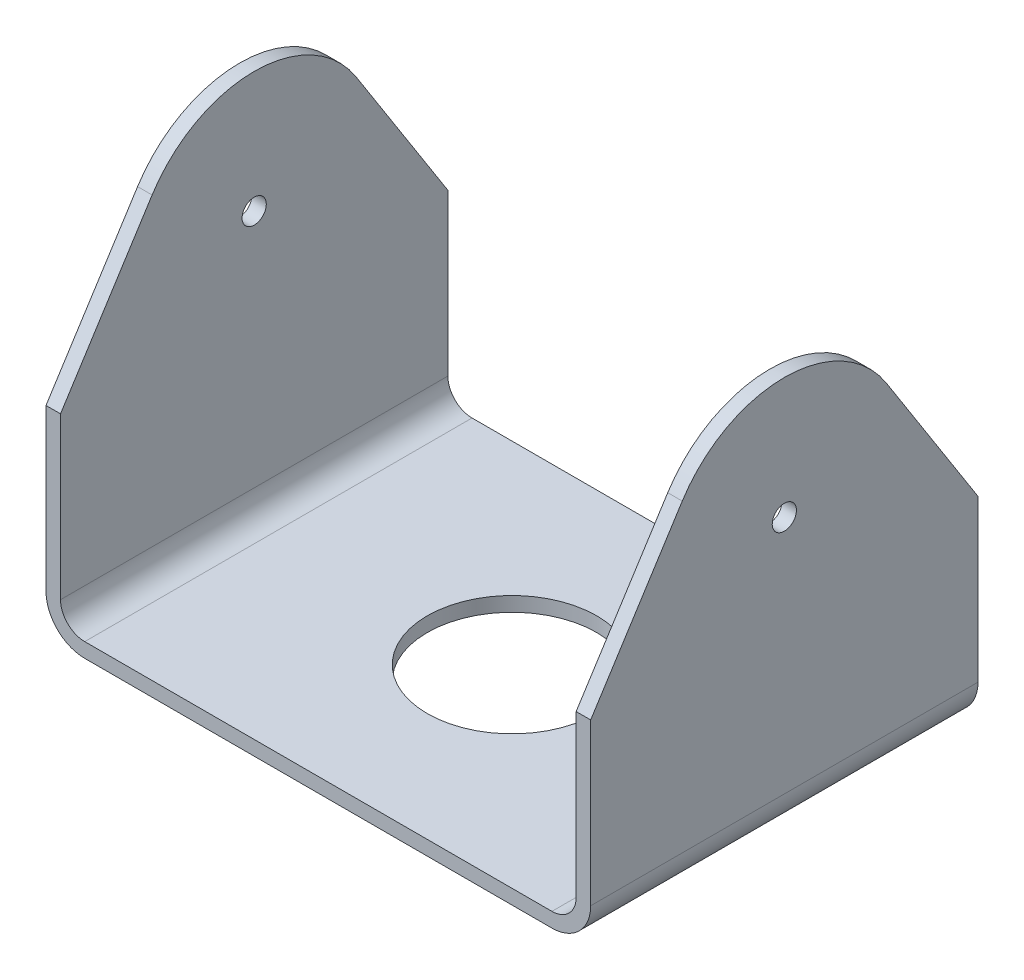
from build123d import *

# Parameters (mm, degrees)
EXTRU_MINCE1_DEPTH      = 40
ENL_V_MAT_EXTRU_1_REACH = 107.282
ESQUISSE2_R             = 17.5
ENL_V_MAT_EXTRU_2_DEPTH = 146.129252737
ESQUISSE4_R             = 2.5
ENL_V_MAT_EXTRU_3_DEPTH = 146.129252737


with BuildPart() as part:
    # Esquisse1 → Extru.-Mince1 (new, symmetric)
    with BuildSketch(Plane.XY):
        with BuildLine():
            Line((-56.25, 82.5), (-56.25, 8))
            ThreePointArc((-56.25, 8), (-53.906854249, 2.343145751), (-48.25, 0))
            Line((-48.25, 0), (48.25, 0))
            ThreePointArc((48.25, 0), (53.906854249, 2.343145751), (56.25, 8))
            Line((56.25, 8), (56.25, 82.5))
            Line((56.25, 82.5), (53.25, 82.5))
            Line((53.25, 82.5), (53.25, 8))
            ThreePointArc((53.25, 8), (51.785533906, 4.464466094), (48.25, 3))
            Line((48.25, 3), (-48.25, 3))
            ThreePointArc((-48.25, 3), (-51.785533906, 4.464466094), (-53.25, 8))
            Line((-53.25, 8), (-53.25, 82.5))
            Line((-53.25, 82.5), (-56.25, 82.5))
        make_face()
    extrude(amount=EXTRU_MINCE1_DEPTH, both=True)

    # Esquisse2 → Enlèv. mat.-Extru.1 (cut, up to next)
    with BuildSketch(Plane(origin=(0, 3, 0), x_dir=(-1, 0, 0), z_dir=(0, 1, 0)), mode=Mode.PRIVATE) as enl_v_mat_extru_1_sk1:
        with Locations(Location((0, 0, 0), (0, 0, 90))):
            Circle(ESQUISSE2_R)
    enl_v_mat_extru_1_tool1 = extrude(enl_v_mat_extru_1_sk1.sketch, amount=-ENL_V_MAT_EXTRU_1_REACH, mode=Mode.PRIVATE) & part.part
    add(enl_v_mat_extru_1_tool1.solids().sort_by_distance((0, 3, 0))[0], mode=Mode.SUBTRACT)

    # Esquisse3 → Enlèv. mat.-Extru.2 (cut, through all)
    with BuildSketch(Plane(origin=(56.25, 0, 0), x_dir=(0, 0, -1), z_dir=(1, 0, 0))):
        with BuildLine():
            Line((-40, 41.241551833), (-21.084786145, 70.932490209))
            ThreePointArc((-21.084786145, 70.932490209), (-12.024719175, 79.418168919), (1.1e-07, 82.5))
            Line((1.1e-07, 82.5), (-40, 82.5))
            Line((-40, 82.5), (-40, 41.241551833))
        make_face()
        with BuildLine():
            Line((40, 82.5), (1.1e-07, 82.5))
            ThreePointArc((1.1e-07, 82.5), (12.024719271, 79.418168866), (21.084786145, 70.932490209))
            Line((21.084786145, 70.932490209), (40, 41.241551833))
            Line((40, 41.241551833), (40, 82.5))
        make_face()
    extrude(amount=-ENL_V_MAT_EXTRU_2_DEPTH, mode=Mode.SUBTRACT)

    # Esquisse4 → Enlèv. mat.-Extru.3 (cut, through all)
    with BuildSketch(Plane(origin=(56.25, 0, 0), x_dir=(0, 0, -1), z_dir=(1, 0, 0))):
        with Locations(Location((0, 57.5, 0), (0, 0, 90))):
            Circle(ESQUISSE4_R)
    extrude(amount=-ENL_V_MAT_EXTRU_3_DEPTH, mode=Mode.SUBTRACT)


solid = part.part
